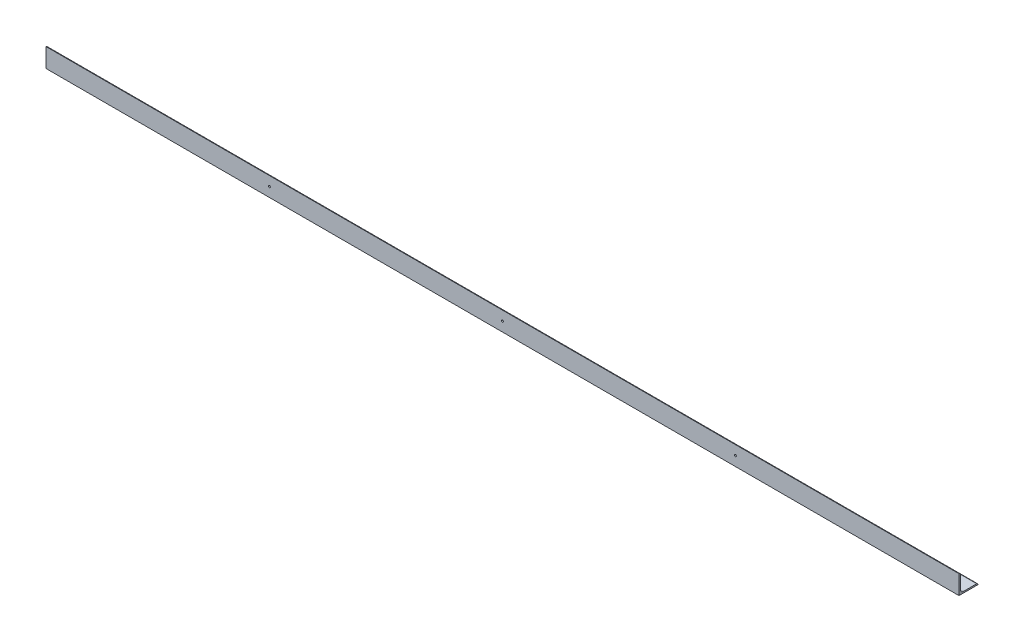
from build123d import *

# Parameters (mm, degrees)
L_ANGLE_EQUAL_40X40X3_2_DEPTH = 1920
SKETCH15_R                    = 2
CUT_EXTRUDE1_DEPTH            = 10
SKETCH16_R                    = 2
CUT_EXTRUDE2_DEPTH            = 3


with BuildPart() as part:
    # Sketch13 → L angle (equal) 40X40X3(2) (new body)
    with BuildSketch(Plane(origin=(0, 0, 0), x_dir=(0, 0, -1), z_dir=(1, 0, 0))):
        with BuildLine():
            Line((0, 40), (0, 0))
            Line((0, 0), (40, 0))
            ThreePointArc((40, 0), (39.121320344, 2.121320344), (37, 3))
            Line((37, 3), (9, 3))
            ThreePointArc((9, 3), (4.757359313, 4.757359313), (3, 9))
            Line((3, 9), (3, 37))
            ThreePointArc((3, 37), (2.121320344, 39.121320344), (0, 40))
        make_face()
    extrude(amount=L_ANGLE_EQUAL_40X40X3_2_DEPTH)

    # Sketch15 → Cut-Extrude1 (cut)
    with BuildSketch(Plane(origin=(0, 0, 0), x_dir=(-1, 0, 0), z_dir=(0, -1, 0))):
        with Locations(Location((-960, 20, 0), (0, 0, 90))):
            Circle(SKETCH15_R)
        with Locations(Location((-470, 20, 0), (0, 0, 90))):
            Circle(SKETCH15_R)
        with Locations(Location((-1450, 20, 0), (0, 0, 90))):
            Circle(SKETCH15_R)
    extrude(amount=-CUT_EXTRUDE1_DEPTH, mode=Mode.SUBTRACT)

    # Sketch16 → Cut-Extrude2 (cut)
    with BuildSketch(Plane.XY):
        with Locations((960, 20)):
            Circle(SKETCH16_R)
        with Locations((1450, 20)):
            Circle(SKETCH16_R)
        with Locations((470, 20)):
            Circle(SKETCH16_R)
    extrude(amount=-CUT_EXTRUDE2_DEPTH, mode=Mode.SUBTRACT)


solid = part.part
